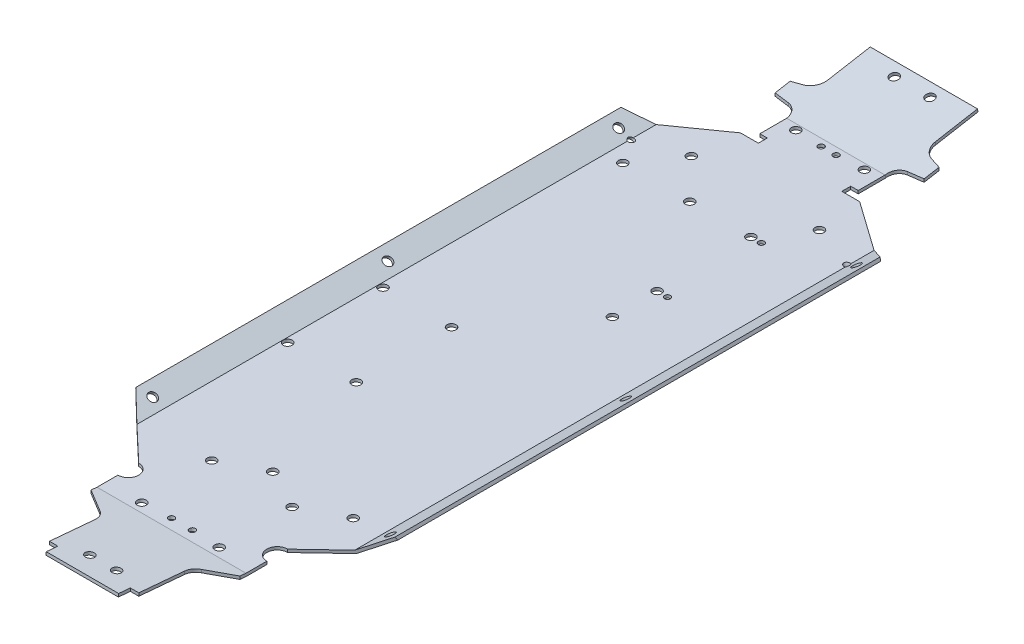
from build123d import *

# Parameters (mm, degrees)
BOSS_EXTRUDE1_DEPTH      = 197
CUT_EXTRUDE3_DEPTH       = 216.79851714
CUT_EXTRUDE3_DEPTH_BACK  = 216.79851714
BOSS_EXTRUDE2_DEPTH      = 88
CUT_EXTRUDE4_DEPTH       = 216.82432282
CUT_EXTRUDE4_DEPTH_BACK  = 216.82432282
BOSS_EXTRUDE3_DEPTH      = 88
CUT_EXTRUDE_Q_DEPTH      = 257.591354983
CUT_EXTRUDE_Q_DEPTH_BACK = 257.591354983
SKETCH11_R               = 1.5
SKETCH11_R_2             = 1
CUT_EXTRUDE5_DEPTH       = 10
SKETCH12_R               = 1.5
SKETCH12_R_2             = 1
CUT_EXTRUDE6_DEPTH       = 10
SKETCH14_R               = 1.5
SKETCH14_R_2             = 1
CUT_EXTRUDE7_DEPTH       = 10
SKETCH16_R               = 1.5
CUT_EXTRUDE8_DEPTH       = 10


with BuildPart() as part:
    # Sketch1 → Boss-Extrude1 (new body)
    with BuildSketch(Plane.XY):
        Polygon((0, 0), (7.160254038, -4.133974596), (80.839745962, -4.133974596), (88, 0), (87.5, 0.866025404), (80.57179677, -3.133974596), (7.42820323, -3.133974596), (0.5, 0.866025404), align=None)
    extrude(amount=BOSS_EXTRUDE1_DEPTH)

    # Sketch3 → Cut-Extrude3 (cut, two sides: drawn at the far end of the back side and taken through both)
    with BuildSketch(Plane(origin=(0, -3.133974596, 0), x_dir=(1, 0, 0), z_dir=(0, 1, 0)).offset(-CUT_EXTRUDE3_DEPTH_BACK)):
        Polygon((0, 0), (0, -17), (7.42820323, -11.738356045), (7.42820323, 0), align=None)
        Polygon((7.42820323, 0), (7.42820323, -11.738356045), (24, 0), align=None)
        Polygon((80.57179677, 0), (64, 0), (80.57179677, -11.738356045), align=None)
        Polygon((80.57179677, 0), (80.57179677, -11.738356045), (88, -17), (88, 0), align=None)
        Polygon((7.42820323, -186.037245166), (0, -179), (0, -197), (7.42820323, -197), align=None)
        Polygon((19, -197), (7.42820323, -186.037245166), (7.42820323, -197), align=None)
        Polygon((80.57179677, -186.037245166), (69, -197), (80.57179677, -197), align=None)
        Polygon((88, -179), (80.57179677, -186.037245166), (80.57179677, -197), (88, -197), align=None)
    extrude(amount=CUT_EXTRUDE3_DEPTH + CUT_EXTRUDE3_DEPTH_BACK, mode=Mode.SUBTRACT)

    # Sketch5 → Boss-Extrude2 (add)
    with BuildSketch(Plane(origin=(0, 0, 0), x_dir=(0, 0, -1), z_dir=(1, 0, 0))):
        Polygon((0, -3.133974596), (12, -3.133974596), (41.54423259, 2.075470734), (41.717880768, 1.090662981), (12.087488664, -4.133974596), (0, -4.133974596), align=None)
    extrude(amount=BOSS_EXTRUDE2_DEPTH)

    # Sketch6 → Cut-Extrude4 (cut, two sides: drawn at the far end of the back side and taken through both)
    with BuildSketch(Plane(origin=(0, -3.133974596, 0), x_dir=(1, 0, 0), z_dir=(0, 1, 0)).offset(-CUT_EXTRUDE4_DEPTH_BACK)):
        with BuildLine():
            Line((24, 0), (30, 0))
            Line((30, 0), (30, 3))
            Line((30, 3), (27.5, 3))
            Line((27.5, 3), (27.5, 12.087488664))
            ThreePointArc((27.5, 12.087488664), (26.488631596, 14.746074976), (23.96595941, 16.060256191))
            Line((23.96595941, 16.060256191), (19, 16.642705453))
            Line((19, 16.642705453), (19, 21.642705453))
            Line((19, 21.642705453), (22.366709334, 22.599401987))
            ThreePointArc((22.366709334, 22.599401987), (24.989583103, 24.39514756), (26, 27.40898675))
            Line((26, 27.40898675), (26, 41.717880768))
            Line((26, 41.717880768), (62, 41.717880768))
            Line((62, 41.717880768), (62, 27.40898675))
            ThreePointArc((62, 27.40898675), (63.010416897, 24.39514756), (65.633290666, 22.599401987))
            Line((65.633290666, 22.599401987), (69, 21.642705453))
            Line((69, 21.642705453), (69, 16.642705453))
            Line((69, 16.642705453), (64.03404059, 16.060256191))
            ThreePointArc((64.03404059, 16.060256191), (61.511368404, 14.746074976), (60.5, 12.087488664))
            Line((60.5, 12.087488664), (60.5, 3))
            Line((60.5, 3), (58, 3))
            Line((58, 3), (58, 0))
            Line((58, 0), (64, 0))
            Line((64, 0), (89.345545356, 0))
            Line((89.345545356, 0), (89.345545356, 57.606108668))
            Line((89.345545356, 57.606108668), (-1.345545356, 57.606108668))
            Line((-1.345545356, 57.606108668), (-1.345545356, 0))
            Line((-1.345545356, 0), (24, 0))
        make_face()
    extrude(amount=CUT_EXTRUDE4_DEPTH + CUT_EXTRUDE4_DEPTH_BACK, mode=Mode.SUBTRACT)

    # Sketch8 → Boss-Extrude3 (add)
    with BuildSketch(Plane(origin=(0, 0, 0), x_dir=(0, 0, -1), z_dir=(1, 0, 0))):
        Polygon((-197, -3.133974596), (-211, -3.133974596), (-240.885840943, -0.519302314), (-240.972996686, -1.515497012), (-211.043660943, -4.133974596), (-197, -4.133974596), align=None)
    extrude(amount=BOSS_EXTRUDE3_DEPTH)

    # Sketch9 → Cut-Extrude q (cut, two sides: drawn at the far end of the back side and taken through both)
    with BuildSketch(Plane(origin=(0, -3.133974596, 0), x_dir=(1, 0, 0), z_dir=(0, 1, 0)).offset(-CUT_EXTRUDE_Q_DEPTH_BACK)):
        with BuildLine():
            Line((29, -221.608495283), (29, -236.972996686))
            Line((29, -236.972996686), (31.84982933, -236.972996686))
            Line((31.84982933, -236.972996686), (31.84982933, -240.972996686))
            Line((31.84982933, -240.972996686), (31.84982933, -252.017077063))
            Line((31.84982933, -252.017077063), (0, -252.017077063))
            Line((0, -252.017077063), (0, -240.885840943))
            Line((0, -240.885840943), (0, -211))
            Line((0, -211), (0, -197))
            Line((0, -197), (19, -197))
            ThreePointArc((19, -197), (22.5, -200.5), (19, -204))
            Line((19, -204), (19, -213))
            Line((19, -213), (27, -218))
            ThreePointArc((27, -218), (28.466564953, -219.545655117), (29, -221.608495283))
        make_face()
        with BuildLine():
            Line((88, -211), (88, -240.885840943))
            Line((88, -240.885840943), (88, -252.017077063))
            Line((88, -252.017077063), (56.15017067, -252.017077063))
            Line((56.15017067, -252.017077063), (56.15017067, -240.972996686))
            Line((56.15017067, -240.972996686), (56.15017067, -236.972996686))
            Line((56.15017067, -236.972996686), (59, -236.972996686))
            Line((59, -236.972996686), (59, -221.608495283))
            ThreePointArc((59, -221.608495283), (59.533435047, -219.545655117), (61, -218))
            Line((61, -218), (69, -213))
            Line((69, -213), (69, -204))
            ThreePointArc((69, -204), (65.5, -200.5), (69, -197))
            Line((69, -197), (88, -197))
            Line((88, -197), (88, -211))
        make_face()
    extrude(amount=CUT_EXTRUDE_Q_DEPTH + CUT_EXTRUDE_Q_DEPTH_BACK, mode=Mode.SUBTRACT)

    # Sketch11 → Cut-Extrude5 (cut)
    with BuildSketch(Plane(origin=(0, -22.42624598, 1.962042289), x_dir=(1, 0, 0), z_dir=(0, -0.9961946980917457, 0.08715574274765849))):
        with Locations(Location((39.5, 232.923937414, 0), (0, 0, 270))):
            Circle(SKETCH11_R)
        with Locations(Location((31, 206.923937414, 0), (0, 0, 90))):
            Circle(SKETCH11_R)
        with Locations(Location((40.5, 206.423937414, 0), (0, 0, 90))):
            Circle(SKETCH11_R_2)
        with Locations(Location((47.5, 206.423937414, 0), (0, 0, 90))):
            Circle(SKETCH11_R_2)
        with Locations(Location((57, 206.923937414, 0), (0, 0, 90))):
            Circle(SKETCH11_R)
        with Locations(Location((48.5, 232.923937414, 0), (0, 0, 270))):
            Circle(SKETCH11_R)
    extrude(amount=-CUT_EXTRUDE5_DEPTH, mode=Mode.SUBTRACT)

    # Sketch12 → Cut-Extrude6 (cut)
    with BuildSketch(Plane(origin=(0, 0, 0), x_dir=(0.866025403784438, -0.5000000000000012, 0), z_dir=(-0.5000000000000011, -0.8660254037844379, 0))):
        with Locations((4.133974596, 177.391699281)):
            Circle(SKETCH12_R)
        with Locations((4.133974596, 98.427887988)):
            Circle(SKETCH12_R)
        with Locations((4.133974596, 20.964076695)):
            Circle(SKETCH12_R)
        with Locations(Location((8.267949192, 20.464076695, 0), (0, 0, 270))):
            Circle(SKETCH12_R_2)
    cut_extrude6 = extrude(amount=-CUT_EXTRUDE6_DEPTH, mode=Mode.SUBTRACT)

    # Mirror1: Cut-Extrude6 across plane
    add(cut_extrude6.mirror(Plane(origin=(44, 0, 0), x_dir=(0, 0, 1), z_dir=(1, 0, 0))), mode=Mode.SUBTRACT)

    # Sketch14 → Cut-Extrude7 (cut)
    with BuildSketch(Plane.XZ.offset(4.133974596)):
        with Locations((30.5, 184)):
            Circle(SKETCH14_R)
        with Locations((22.5, 15)):
            Circle(SKETCH14_R)
        with Locations((44, 177)):
            Circle(SKETCH14_R)
        with Locations(Location((65.5, 15, 0), (0, 0, 270))):
            Circle(SKETCH14_R)
        with Locations(Location((57.5, 184, 0), (0, 0, 270))):
            Circle(SKETCH14_R)
        with Locations((71, 177)):
            Circle(SKETCH14_R)
        with Locations((9, 137)):
            Circle(SKETCH14_R)
        with Locations((32, 105)):
            Circle(SKETCH14_R)
        with Locations((32, 137)):
            Circle(SKETCH14_R)
        with Locations((9, 105)):
            Circle(SKETCH14_R)
        with Locations((13, 28.5)):
            Circle(SKETCH14_R)
        with Locations((35.5, 28.5)):
            Circle(SKETCH14_R)
        with Locations((56, 28.5)):
            Circle(SKETCH14_R)
        with Locations((59.5, 28.5)):
            Circle(SKETCH14_R_2)
        with Locations((56, 75)):
            Circle(SKETCH14_R)
        with Locations((56, 60)):
            Circle(SKETCH14_R)
        with Locations((55.5, -10.087488664)):
            Circle(SKETCH14_R)
        with Locations((32.5, -10.087488664)):
            Circle(SKETCH14_R)
        with Locations((46.5, -9.587488664)):
            Circle(SKETCH14_R_2)
        with Locations((41.5, -9.587488664)):
            Circle(SKETCH14_R_2)
        with Locations((59.5, 60)):
            Circle(SKETCH14_R_2)
    extrude(amount=-CUT_EXTRUDE7_DEPTH, mode=Mode.SUBTRACT)

    # Sketch16 → Cut-Extrude8 (cut)
    with BuildSketch(Plane(origin=(0, -6.076402312, -1.071433673), x_dir=(1, 0, 0), z_dir=(0, -0.9848077530122079, -0.17364817766693125))):
        with Locations(Location((38, -37.273484059, 0), (0, 0, 270))):
            Circle(SKETCH16_R)
        with Locations(Location((50, -37.273484059, 0), (0, 0, 270))):
            Circle(SKETCH16_R)
    extrude(amount=-CUT_EXTRUDE8_DEPTH, mode=Mode.SUBTRACT)


solid = part.part
